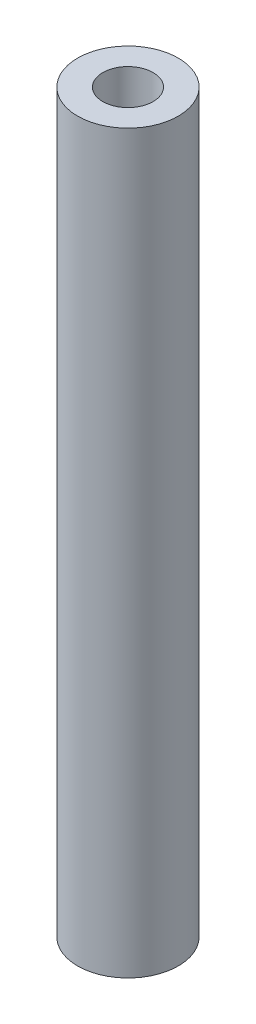
from build123d import *

# Parameters (mm, degrees)
SKETCH1_R           = 4
SKETCH1_R_2         = 2
BOSS_EXTRUDE1_DEPTH = 58.5


with BuildPart() as part:
    # Sketch1 → Boss-Extrude1 (new body)
    with BuildSketch(Plane(origin=(0, 0, 0), x_dir=(1, 0, 0), z_dir=(0, 1, 0))):
        with Locations(Location((0, 0, 0), (0, 0, 270))):
            Circle(SKETCH1_R)
        with Locations(Location((0, 0, 0), (0, 0, 270))):
            Circle(SKETCH1_R_2, mode=Mode.SUBTRACT)
    extrude(amount=BOSS_EXTRUDE1_DEPTH)


solid = part.part
